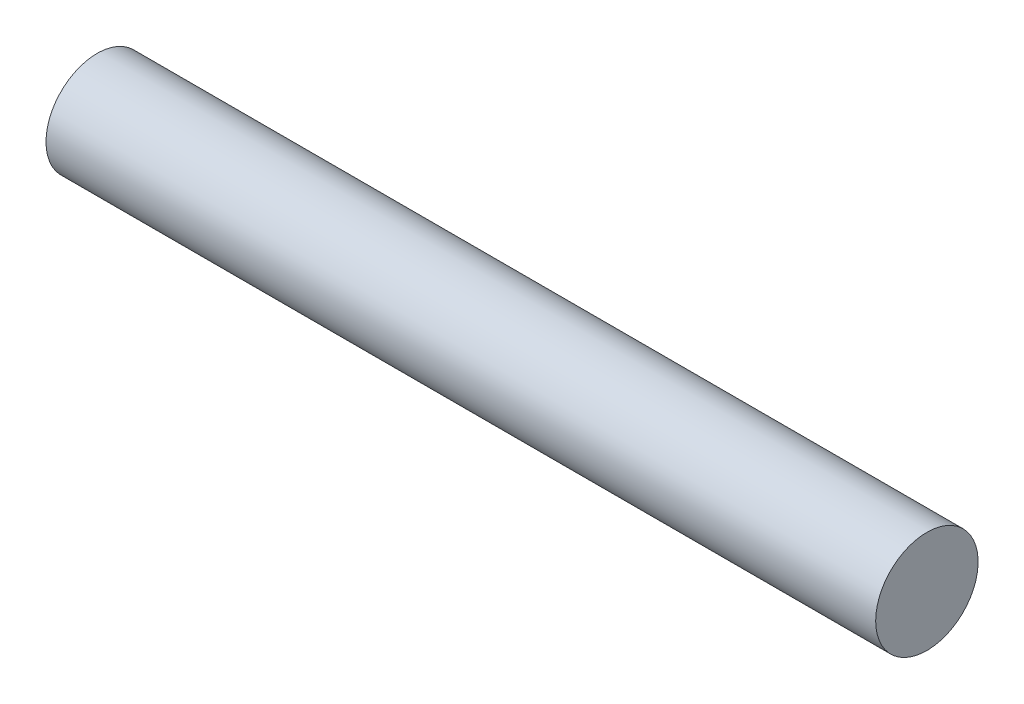
from build123d import *

# Parameters (mm, degrees)
SKETCH1_W = 24.3
SKETCH1_H = 1.5


with BuildPart() as part:
    # Sketch1 → Revolve1 (revolve)
    with BuildSketch(Plane.XY, mode=Mode.PRIVATE) as revolve1_sk:
        with Locations((12.15, 0.75)):
            Rectangle(SKETCH1_W, SKETCH1_H)
    revolve(revolve1_sk.sketch.rotate(Axis((0, 0, 0), (1, 0, 0)), 90), axis=Axis((0, 0, 0), (1, 0, 0)))


solid = part.part
